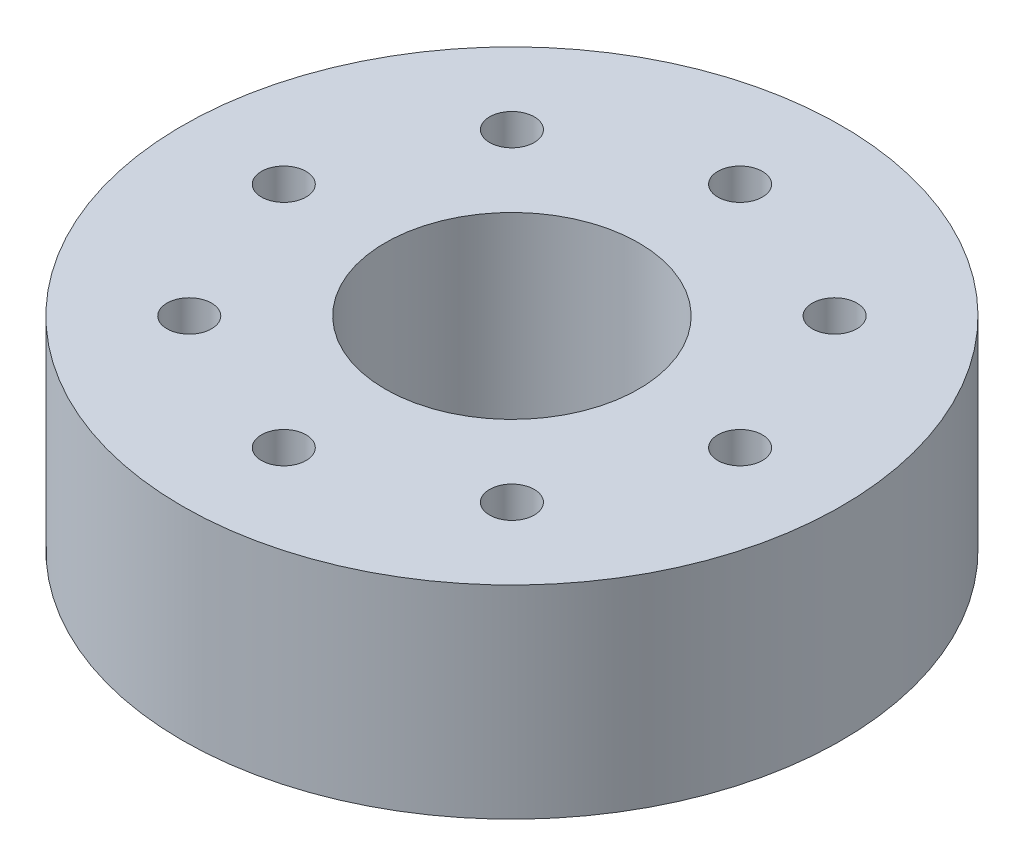
from build123d import *

# Parameters (mm, degrees)
SKETCH1_R           = 32.5
BOSS_EXTRUDE1_DEPTH = 20
SKETCH2_R           = 2.2
CUT_EXTRUDE1_DEPTH  = 51.124844139
SKETCH3_R           = 12.5
CUT_EXTRUDE2_DEPTH  = 51.124844139


with BuildPart() as part:
    # Sketch1 → Boss-Extrude1 (new body)
    with BuildSketch(Plane(origin=(0, 0, 0), x_dir=(1, 0, 0), z_dir=(0, 1, 0))):
        with Locations(Location((0, 0, 0), (0, 0, 270))):
            Circle(SKETCH1_R)
    extrude(amount=BOSS_EXTRUDE1_DEPTH)

    # Sketch2 → Cut-Extrude1 (cut, through all)
    with BuildSketch(Plane(origin=(0, 20, 0), x_dir=(1, 0, 0), z_dir=(0, 1, 0))):
        with Locations(Location((0, 22.5, 0), (0, 0, 270))):
            Circle(SKETCH2_R)
        with Locations(Location((15.909902577, 15.909902577, 0), (0, 0, 270))):
            Circle(SKETCH2_R)
        with Locations(Location((22.5, 0, 0), (0, 0, 270))):
            Circle(SKETCH2_R)
        with Locations(Location((15.909902577, -15.909902577, 0), (0, 0, 270))):
            Circle(SKETCH2_R)
        with Locations(Location((0, -22.5, 0), (0, 0, 270))):
            Circle(SKETCH2_R)
        with Locations(Location((-15.909902577, -15.909902577, 0), (0, 0, 270))):
            Circle(SKETCH2_R)
        with Locations(Location((-22.5, 0, 0), (0, 0, 270))):
            Circle(SKETCH2_R)
        with Locations(Location((-15.909902577, 15.909902577, 0), (0, 0, 270))):
            Circle(SKETCH2_R)
    extrude(amount=-CUT_EXTRUDE1_DEPTH, mode=Mode.SUBTRACT)

    # Sketch3 → Cut-Extrude2 (cut, through all)
    with BuildSketch(Plane(origin=(0, 20, 0), x_dir=(1, 0, 0), z_dir=(0, 1, 0))):
        with Locations(Location((0, 0, 0), (0, 0, 270))):
            Circle(SKETCH3_R)
    extrude(amount=-CUT_EXTRUDE2_DEPTH, mode=Mode.SUBTRACT)


solid = part.part
